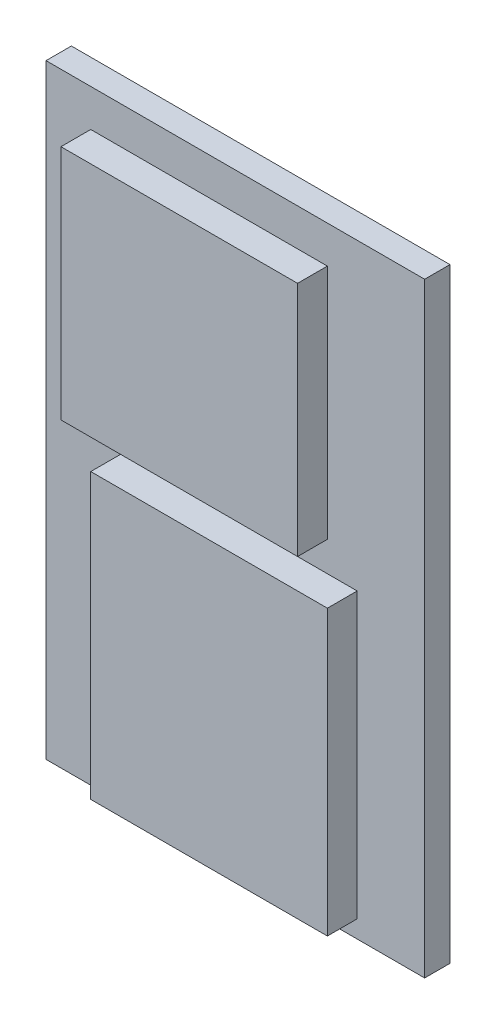
from build123d import *

# Parameters (mm, degrees)
SKETCH1_W           = 25.4
SKETCH1_H           = 40.6
BOSS_EXTRUDE1_DEPTH = 1.7
SKETCH2_W           = 8
SKETCH2_H           = 7
BOSS_EXTRUDE2_DEPTH = 2.5
CUT_EXTRUDE2_DEPTH  = 5
FILLET1_R           = 1
FILLET2_R           = 1
SKETCH4_W           = 18.8
SKETCH4_H           = 19.2
BOSS_EXTRUDE3_DEPTH = 2.5
SKETCH5_R           = 1.75
BOSS_EXTRUDE4_DEPTH = 2
SKETCH6_W           = 0.5
SKETCH6_H           = 1
BOSS_EXTRUDE5_DEPTH = 0.5
SKETCH7_W           = 2
SKETCH7_H           = 3
BOSS_EXTRUDE6_DEPTH = 2
SKETCH8_W           = 15.875
SKETCH8_H           = 15.875
SKETCH8_H_2         = 19.05
BOSS_EXTRUDE7_DEPTH = 2


with BuildPart() as part:
    # Sketch1 → Boss-Extrude1 (new body)
    with BuildSketch(Plane.XY):
        Rectangle(SKETCH1_W, SKETCH1_H)
    extrude(amount=BOSS_EXTRUDE1_DEPTH)

    # Sketch2 → Boss-Extrude2 (add)
    with BuildSketch(Plane.XY):
        with Locations((0, -16.8)):
            Rectangle(SKETCH2_W, SKETCH2_H)
    extrude(amount=-BOSS_EXTRUDE2_DEPTH)

    # Sketch3 → Cut-Extrude2 (cut)
    with BuildSketch(Plane.XZ.offset(20.3)):
        Polygon((3.5, -2.125), (3.5, -1.125), (2.375, 0), (-2.375, 0), (-3.5, -1.125), (-3.5, -2.125), align=None)
    extrude(amount=-CUT_EXTRUDE2_DEPTH, mode=Mode.SUBTRACT)

    # Fillet1
    fillet1_edges = [part.edges().sort_by_distance(p)[0] for p in [
        (4, -16.8, -2.5),
        (-4, -16.8, -2.5),
    ]]
    fillet(fillet1_edges, radius=FILLET1_R)

    # Fillet2
    fillet2_edges = [part.edges().sort_by_distance(p)[0] for p in [
        (4, -16.8, 0),
        (-4, -16.8, 0),
    ]]
    fillet(fillet2_edges, radius=FILLET2_R)

    # Sketch4 → Boss-Extrude3 (add)
    with BuildSketch(Plane(origin=(0, 0, 0), x_dir=(-1, 0, 0), z_dir=(0, 0, -1))):
        Rectangle(SKETCH4_W, SKETCH4_H)
    extrude(amount=BOSS_EXTRUDE3_DEPTH)

    # Sketch5 → Boss-Extrude4 (add)
    with BuildSketch(Plane(origin=(0, 0, 0), x_dir=(-1, 0, 0), z_dir=(0, 0, -1))):
        with Locations((-8.2, -17.8)):
            Circle(SKETCH5_R)
    extrude(amount=BOSS_EXTRUDE4_DEPTH)

    # Sketch6 → Boss-Extrude5 (add)
    with BuildSketch(Plane(origin=(0, 0, 0), x_dir=(-1, 0, 0), z_dir=(0, 0, -1))):
        with Locations((-7.2, -11.1)):
            Rectangle(SKETCH6_W, SKETCH6_H)
        with Locations((-6.45, -11.1)):
            Rectangle(SKETCH6_W, SKETCH6_H)
    extrude(amount=BOSS_EXTRUDE5_DEPTH)

    # Sketch7 → Boss-Extrude6 (add)
    with BuildSketch(Plane(origin=(0, 0, 0), x_dir=(-1, 0, 0), z_dir=(0, 0, -1))):
        with Locations((-9.2, 16.3)):
            Rectangle(SKETCH7_W, SKETCH7_H)
        with Locations((9.2, 16.3)):
            Rectangle(SKETCH7_W, SKETCH7_H)
    extrude(amount=BOSS_EXTRUDE6_DEPTH)

    # Sketch8 → Boss-Extrude7 (add)
    with BuildSketch(Plane.XY.offset(1.7)):
        with Locations((-1.7625, 9.8625)):
            Rectangle(SKETCH8_W, SKETCH8_H)
        with Locations((0.2375, -9.6)):
            Rectangle(SKETCH8_W, SKETCH8_H_2)
    extrude(amount=BOSS_EXTRUDE7_DEPTH)


solid = part.part
